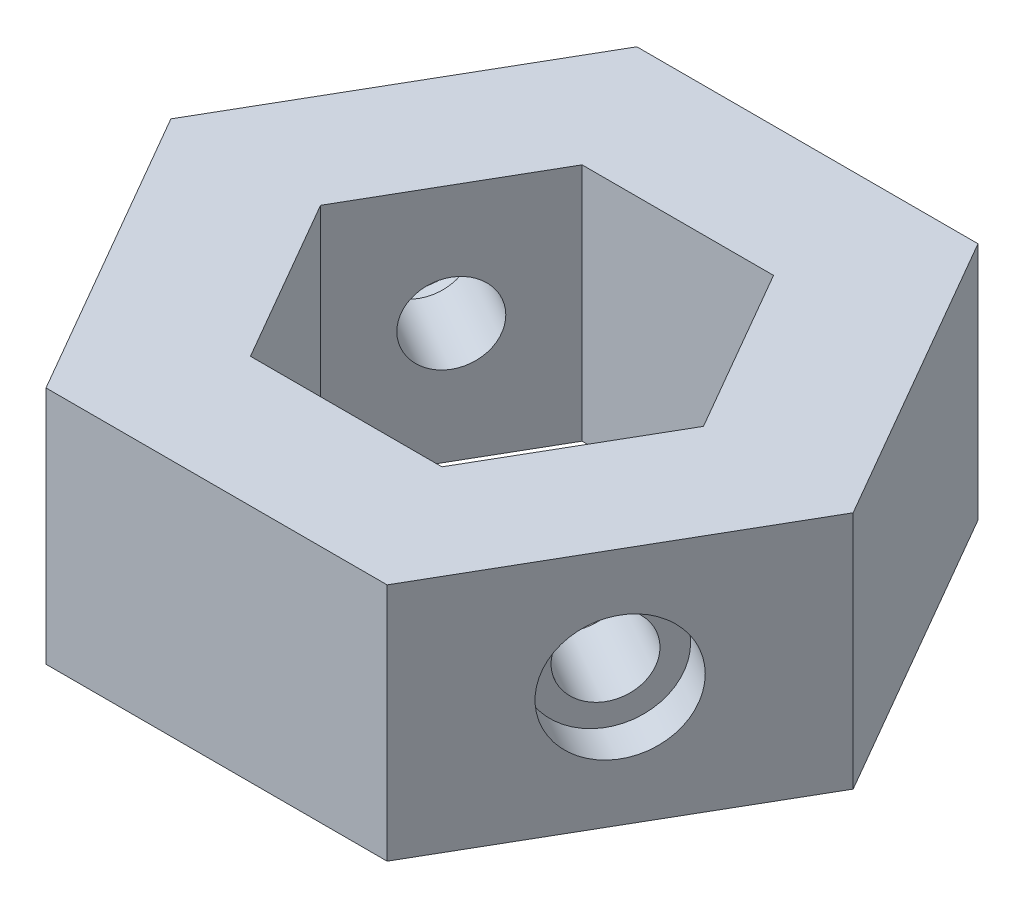
from build123d import *

# Parameters (mm, degrees)
BOSS_EXTRUDE1_DEPTH = 9.525
SKETCH2_R           = 2.48046875
CUT_EXTRUDE1_DEPTH  = 1.5875
SKETCH3_R           = 1.5875
CUT_EXTRUDE2_DEPTH  = 6.35
SKETCH4_R           = 2.45760875
CUT_EXTRUDE3_DEPTH  = 1.5875
CUT_EXTRUDE4_START  = -6.35
SKETCH5_R           = 1.5875
CUT_EXTRUDE4_DEPTH  = 6.35


with BuildPart() as part:
    # Sketch1 → Boss-Extrude1 (new body)
    with BuildSketch(Plane(origin=(0, 0, 0), x_dir=(1, 0, 0), z_dir=(0, 1, 0))):
        Polygon((13.57753309, 0), (6.788766545, 11.758488577), (-6.788766545, 11.758488577), (-13.57753309, 0), (-6.788766545, -11.758488577), (6.788766545, -11.758488577), align=None)
        Polygon((7.62, 0), (3.81, 6.599113577), (-3.81, 6.599113577), (-7.62, 0), (-3.81, -6.599113577), (3.81, -6.599113577), align=None, mode=Mode.SUBTRACT)
    extrude(amount=BOSS_EXTRUDE1_DEPTH)

    # Sketch2 → Cut-Extrude1 (cut)
    with BuildSketch(Plane(origin=(10.183149818, 0, 5.879244288), x_dir=(0.4999999999999997, 0, -0.8660254037844389), z_dir=(0.8660254037844389, 0, 0.4999999999999997))):
        with Locations((0, 4.7625)):
            Circle(SKETCH2_R)
    extrude(amount=-CUT_EXTRUDE1_DEPTH, mode=Mode.SUBTRACT)

    # Sketch3 → Cut-Extrude2 (cut)
    with BuildSketch(Plane(origin=(8.808334489, 0, 5.085494288), x_dir=(0.49999999999999983, 0, -0.8660254037844388), z_dir=(0.8660254037844387, 0, 0.4999999999999998))):
        with Locations((0, 4.7625)):
            Circle(SKETCH3_R)
    extrude(amount=-CUT_EXTRUDE2_DEPTH, mode=Mode.SUBTRACT)

    # Sketch4 → Cut-Extrude3 (cut)
    with BuildSketch(Plane(origin=(-10.183149818, 0, -5.879244288), x_dir=(-0.4999999999999997, 0, 0.8660254037844389), z_dir=(-0.8660254037844389, 0, -0.4999999999999997))):
        with Locations((0, 4.7625)):
            Circle(SKETCH4_R)
    extrude(amount=-CUT_EXTRUDE3_DEPTH, mode=Mode.SUBTRACT)

    # Sketch5 → Cut-Extrude4 (cut)
    with BuildSketch(Plane(origin=(-8.808334489, 0, -5.085494288), x_dir=(-0.49999999999999983, 0, 0.8660254037844388), z_dir=(-0.8660254037844387, 0, -0.4999999999999998)).offset(CUT_EXTRUDE4_START)):
        with Locations(Location((0, 4.7625, 0), (0, 0, 180))):
            Circle(SKETCH5_R)
    extrude(amount=CUT_EXTRUDE4_DEPTH, mode=Mode.SUBTRACT)


solid = part.part
